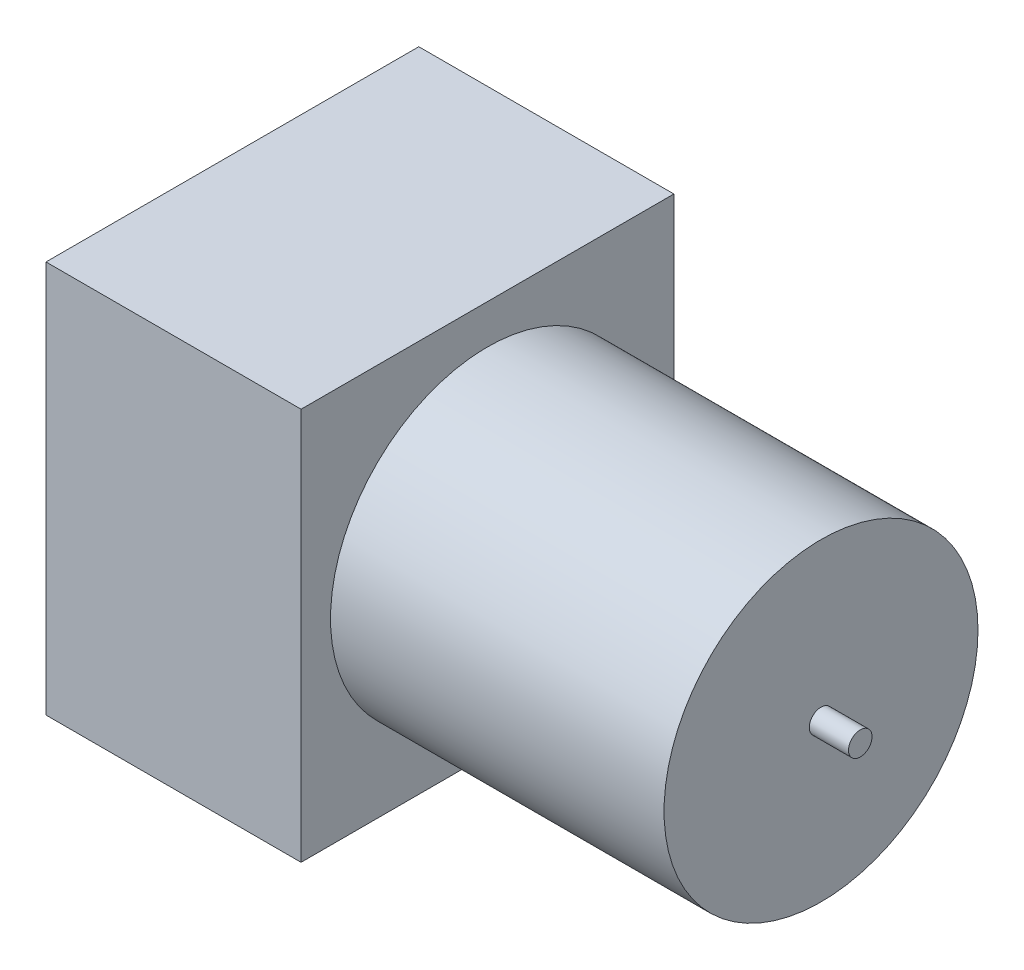
from build123d import *

# Parameters (mm, degrees)
SKETCH1_W           = 65
SKETCH1_H           = 95
PUMP_HEAD_DEPTH     = 100
MOTOR_START         = 65
SKETCH2_R           = 40
MOTOR_DEPTH         = 85
INLET_PORT_START    = -12
SKETCH3_R           = 6
INLET_PORT_DEPTH    = 12
INLET_SOCKET_START  = -12
SKETCH4_R           = 3.2
INLET_SOCKET_DEPTH  = 10
OUTLET_PORT_START   = -12
SKETCH5_R           = 6
OUTLET_PORT_DEPTH   = 12
OUTLET_SOCKET_START = -12
SKETCH6_R           = 3.2
OUTLET_SOCKET_DEPTH = 10
CABLE_STUB_START    = 150
SKETCH7_R           = 3
CABLE_STUB_DEPTH    = 10


with BuildPart() as part:
    # Sketch1 → Pump_Head (new body)
    with BuildSketch(Plane(origin=(0, 0, 0), x_dir=(1, 0, 0), z_dir=(0, 1, 0))):
        with Locations((32.5, 0)):
            Rectangle(SKETCH1_W, SKETCH1_H)
    extrude(amount=PUMP_HEAD_DEPTH)

    # Sketch2 → Motor (add)
    with BuildSketch(Plane(origin=(0, 0, 0), x_dir=(0, 0, -1), z_dir=(1, 0, 0)).offset(MOTOR_START)):
        with Locations((0, 50)):
            Circle(SKETCH2_R)
    extrude(amount=MOTOR_DEPTH)

    # Sketch3 → Inlet_Port (add)
    with BuildSketch(Plane(origin=(0, 0, 0), x_dir=(0, 0, -1), z_dir=(1, 0, 0)).offset(INLET_PORT_START)):
        with Locations((0, 30)):
            Circle(SKETCH3_R)
    extrude(amount=INLET_PORT_DEPTH)

    # Sketch4 → Inlet_Socket (cut)
    with BuildSketch(Plane(origin=(0, 0, 0), x_dir=(0, 0, -1), z_dir=(1, 0, 0)).offset(INLET_SOCKET_START)):
        with Locations((0, 30)):
            Circle(SKETCH4_R)
    extrude(amount=INLET_SOCKET_DEPTH, mode=Mode.SUBTRACT)

    # Sketch5 → Outlet_Port (add)
    with BuildSketch(Plane(origin=(0, 0, 0), x_dir=(0, 0, -1), z_dir=(1, 0, 0)).offset(OUTLET_PORT_START)):
        with Locations((0, 70)):
            Circle(SKETCH5_R)
    extrude(amount=OUTLET_PORT_DEPTH)

    # Sketch6 → Outlet_Socket (cut)
    with BuildSketch(Plane(origin=(0, 0, 0), x_dir=(0, 0, -1), z_dir=(1, 0, 0)).offset(OUTLET_SOCKET_START)):
        with Locations((0, 70)):
            Circle(SKETCH6_R)
    extrude(amount=OUTLET_SOCKET_DEPTH, mode=Mode.SUBTRACT)

    # Sketch7 → Cable_Stub (add)
    with BuildSketch(Plane(origin=(0, 0, 0), x_dir=(0, 0, -1), z_dir=(1, 0, 0)).offset(CABLE_STUB_START)):
        with Locations((0, 50)):
            Circle(SKETCH7_R)
    extrude(amount=CABLE_STUB_DEPTH)


solid = part.part
